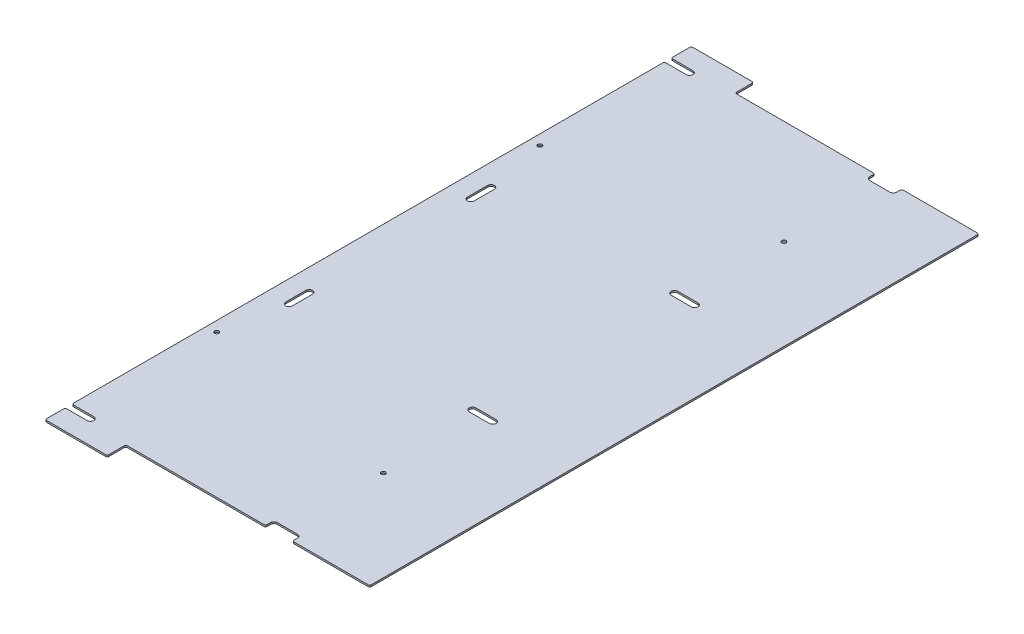
from build123d import *

# Parameters (mm, degrees)
SKETCH1_W                      = 609.6
SKETCH1_H                      = 1219.2
BOSS_EXTRUDE1_DEPTH            = 3.175
F_5_16_0_3125_DIAMETER_HOLE1_D = 7.9375
SKETCH5_W                      = 920.75
SKETCH5_H                      = 34.925
CUT_EXTRUDE2_DEPTH             = 1364.110736743
CUT_EXTRUDE1_DEPTH             = 1364.110736743
SKETCH6_W                      = 0.254
SKETCH6_H                      = 1149.35
CUT_EXTRUDE3_DEPTH             = 1364.110736743
CUT_EXTRUDE4_DEPTH             = 1363.997163732
SKETCH14_W                     = 50.8
SKETCH14_H                     = 9.525
CUT_EXTRUDE5_DEPTH             = 1363.997163732
FILLET1_R                      = 3.175


with BuildPart() as part:
    # Sketch1 → Boss-Extrude1 (new body)
    with BuildSketch(Plane(origin=(0, 0, 0), x_dir=(1, 0, 0), z_dir=(0, 1, 0))):
        with Locations((304.8, 609.6)):
            Rectangle(SKETCH1_W, SKETCH1_H)
    extrude(amount=BOSS_EXTRUDE1_DEPTH)

    # 5/16 (0.3125) Diameter Hole1 (through all)
    with Locations(Plane(origin=(0, 3.175, 0), x_dir=(1, 0, 0), z_dir=(0, 1, 0))):
        with Locations((50.8, 914.4), (50.8, 304.8), (438.15, 987.425), (438.15, 231.775)):
            Hole(F_5_16_0_3125_DIAMETER_HOLE1_D / 2)

    # Sketch5 → Cut-Extrude2 (cut, through all)
    with BuildSketch(Plane(origin=(0, 3.175, 0), x_dir=(1, 0, 0), z_dir=(0, 1, 0))):
        with Locations((609.6, 1201.7375)):
            Rectangle(SKETCH5_W, SKETCH5_H)
        with Locations((609.6, 17.4625)):
            Rectangle(SKETCH5_W, SKETCH5_H)
    extrude(amount=-CUT_EXTRUDE2_DEPTH, mode=Mode.SUBTRACT)

    # Sketch2 → Cut-Extrude1 (cut, through all)
    with BuildSketch(Plane(origin=(0, 3.175, 0), x_dir=(1, 0, 0), z_dir=(0, 1, 0))):
        Polygon((0, 0), (0, 1219.2), (31.75, 1219.2), (31.75, 812.8), (31.75, 406.4), (31.75, 0), align=None)
    extrude(amount=-CUT_EXTRUDE1_DEPTH, mode=Mode.SUBTRACT)

    # Sketch6 → Cut-Extrude3 (cut, through all)
    with BuildSketch(Plane.XZ):
        with Locations((609.473, -609.6)):
            Rectangle(SKETCH6_W, SKETCH6_H)
    extrude(amount=-CUT_EXTRUDE3_DEPTH, mode=Mode.SUBTRACT)

    # Sketch13 → Cut-Extrude4 (cut, through all)
    with BuildSketch(Plane(origin=(0, 3.175, 0), x_dir=(1, 0, 0), z_dir=(0, 1, 0))):
        with BuildLine():
            Line((66.675, 419.1), (66.675, 457.2))
            ThreePointArc((66.675, 457.2), (73.025, 463.55), (79.375, 457.2))
            Line((79.375, 457.2), (79.375, 419.1))
            ThreePointArc((79.375, 419.1), (73.025, 412.75), (66.675, 419.1))
        make_face()
        with BuildLine():
            Line((419.1, 425.45), (457.2, 425.45))
            ThreePointArc((457.2, 425.45), (463.55, 419.1), (457.2, 412.75))
            Line((457.2, 412.75), (419.1, 412.75))
            ThreePointArc((419.1, 412.75), (412.75, 419.1), (419.1, 425.45))
        make_face()
        with BuildLine():
            Line((28.575, 50.8), (73.025, 50.8))
            ThreePointArc((73.025, 50.8), (79.375, 44.45), (73.025, 38.1))
            Line((73.025, 38.1), (28.575, 38.1))
            ThreePointArc((28.575, 38.1), (22.225, 44.45), (28.575, 50.8))
        make_face()
        with BuildLine():
            Line((419.1, 50.8), (457.2, 50.8))
            ThreePointArc((457.2, 50.8), (463.55, 44.45), (457.2, 38.1))
            Line((457.2, 38.1), (419.1, 38.1))
            ThreePointArc((419.1, 38.1), (412.75, 44.45), (419.1, 50.8))
        make_face()
        with BuildLine():
            Line((66.675, 800.1), (66.675, 762))
            ThreePointArc((66.675, 762), (73.025, 755.65), (79.375, 762))
            Line((79.375, 762), (79.375, 800.1))
            ThreePointArc((79.375, 800.1), (73.025, 806.45), (66.675, 800.1))
        make_face()
        with BuildLine():
            Line((419.1, 793.75), (457.2, 793.75))
            ThreePointArc((457.2, 793.75), (463.55, 800.1), (457.2, 806.45))
            Line((457.2, 806.45), (419.1, 806.45))
            ThreePointArc((419.1, 806.45), (412.75, 800.1), (419.1, 793.75))
        make_face()
        with BuildLine():
            Line((28.575, 1168.4), (73.025, 1168.4))
            ThreePointArc((73.025, 1168.4), (79.375, 1174.75), (73.025, 1181.1))
            Line((73.025, 1181.1), (28.575, 1181.1))
            ThreePointArc((28.575, 1181.1), (22.225, 1174.75), (28.575, 1168.4))
        make_face()
        with BuildLine():
            Line((419.1, 1168.4), (457.2, 1168.4))
            ThreePointArc((457.2, 1168.4), (463.55, 1174.75), (457.2, 1181.1))
            Line((457.2, 1181.1), (419.1, 1181.1))
            ThreePointArc((419.1, 1181.1), (412.75, 1174.75), (419.1, 1168.4))
        make_face()
    extrude(amount=-CUT_EXTRUDE4_DEPTH, mode=Mode.SUBTRACT)

    # Sketch14 → Cut-Extrude5 (cut, through all)
    with BuildSketch(Plane(origin=(0, 3.175, 0), x_dir=(1, 0, 0), z_dir=(0, 1, 0))):
        with Locations((438.15, 39.6875)):
            Rectangle(SKETCH14_W, SKETCH14_H)
        with Locations((438.15, 1179.5125)):
            Rectangle(SKETCH14_W, SKETCH14_H)
    extrude(amount=-CUT_EXTRUDE5_DEPTH, mode=Mode.SUBTRACT)

    # Fillet1
    fillet1_edges = [part.edges().sort_by_distance(p)[0] for p in [
        (609.346, 1.5875, -1184.275),
        (609.346, 1.5875, -34.925),
        (31.75, 1.5875, -1168.4),
        (31.75, 1.5875, -1181.1),
        (31.75, 1.5875, -38.1),
        (31.75, 1.5875, -50.8),
        (463.55, 1.5875, -34.925),
        (412.75, 1.5875, -34.925),
        (463.55, 1.5875, -1184.275),
        (412.75, 1.5875, -1184.275),
        (149.225, 1.5875, -1219.2),
        (149.225, 1.5875, -1184.275),
        (149.225, 1.5875, -34.925),
        (149.225, 1.5875, 0),
        (31.75, 1.5875, -1219.2),
        (31.75, 1.5875, 0),
    ]]
    fillet(fillet1_edges, radius=FILLET1_R)


solid = part.part
